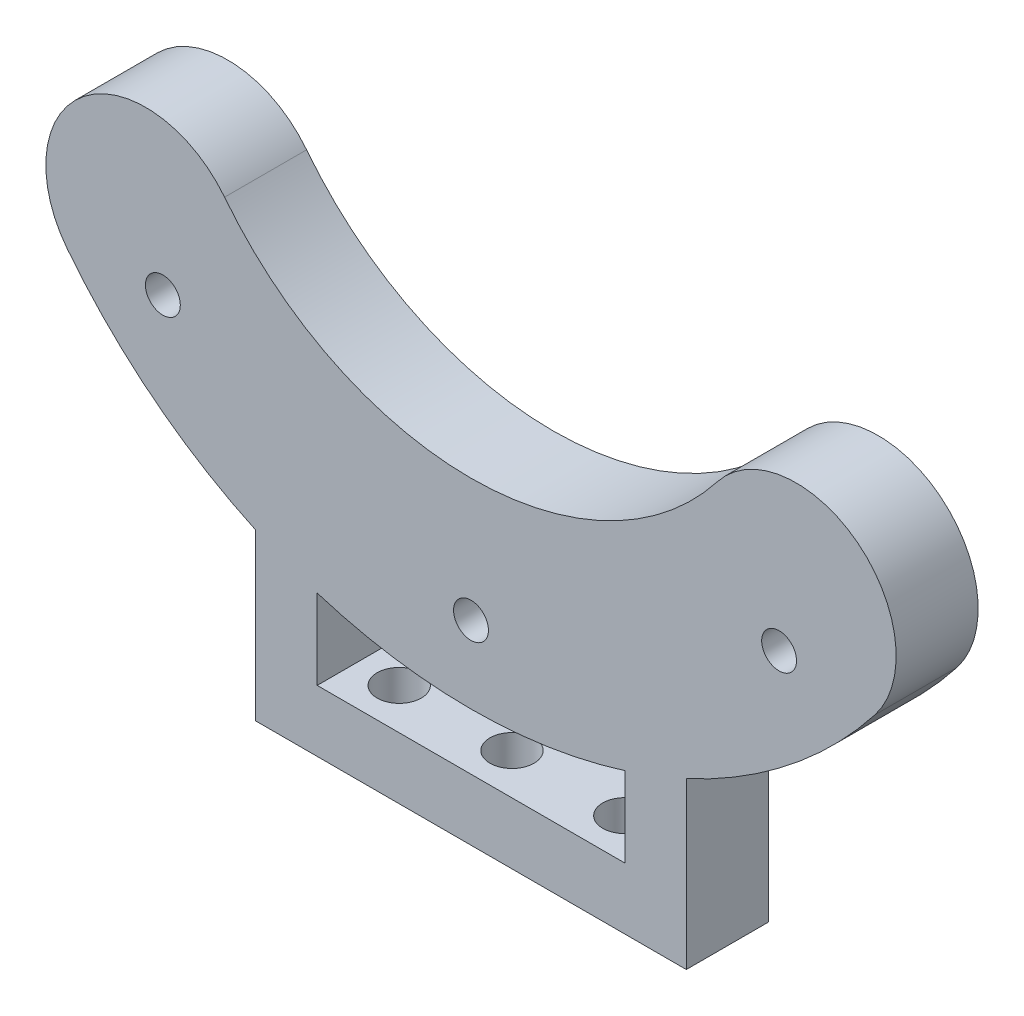
from build123d import *

# Parameters (mm, degrees)
SKETCH_1_R          = 50
SKETCH_1_R_2        = 1.7
EXTRUDE_1_DEPTH     = 8
SKETCH_2_R          = 30.5
CUT_EXTRUDE_1_DEPTH = 8
CUT_EXTRUDE_6_DEPTH = 84
EXTRUDE_START       = -8
EXTRUDE_5_DEPTH     = 8
SKETCH_10_R         = 2.15
CUT_EXTRUDE_7_DEPTH = 8


with BuildPart() as part:
    # 草图1 → 凸台-拉伸1 (new body)
    with BuildSketch(Plane.XY):
        Circle(SKETCH_1_R)
        with Locations((0, 42.5)):
            Circle(SKETCH_1_R_2, mode=Mode.SUBTRACT)
        with Locations((30.0520382, 30.0520382)):
            Circle(SKETCH_1_R_2, mode=Mode.SUBTRACT)
        with Locations((42.5, 0)):
            Circle(SKETCH_1_R_2, mode=Mode.SUBTRACT)
        with Locations((30.0520382, -30.0520382)):
            Circle(SKETCH_1_R_2, mode=Mode.SUBTRACT)
        with Locations((0, -42.5)):
            Circle(SKETCH_1_R_2, mode=Mode.SUBTRACT)
        with Locations((-30.0520382, -30.0520382)):
            Circle(SKETCH_1_R_2, mode=Mode.SUBTRACT)
        with Locations((-42.5, 0)):
            Circle(SKETCH_1_R_2, mode=Mode.SUBTRACT)
        with Locations((-30.0520382, 30.0520382)):
            Circle(SKETCH_1_R_2, mode=Mode.SUBTRACT)
    extrude(amount=EXTRUDE_1_DEPTH)

    # 草图2 → 切除-拉伸1 (cut)
    with BuildSketch(Plane.XY.offset(8)):
        Circle(SKETCH_2_R)
    extrude(amount=-CUT_EXTRUDE_1_DEPTH, mode=Mode.SUBTRACT)

    # 草图3 → 切除-拉伸6 (cut)
    with BuildSketch(Plane.XY.offset(8)):
        with BuildLine():
            ThreePointArc((-39.400537164, -30.783074428), (-37.720132642, -17.097269866), (-24.034328132, -18.77767481))
            ThreePointArc((-24.034328132, -18.77767481), (9.7e-08, 30.5), (24.034328012, -18.777674963))
            ThreePointArc((24.034328012, -18.777674963), (37.720132595, -17.097269829), (39.400537117, -30.783074488))
            ThreePointArc((39.400537117, -30.783074488), (3.8e-08, 50), (-39.400537164, -30.783074428))
        make_face()
    extrude(amount=-CUT_EXTRUDE_6_DEPTH, mode=Mode.SUBTRACT)

    # 草图8 → 凸台-拉伸5 (add)
    with BuildSketch(Plane.XY.offset(8).offset(EXTRUDE_START)):
        with BuildLine():
            ThreePointArc((-15, -47.696960071), (-18.037363326, -46.633180507), (-21, -45.376205218))
            Line((-21, -45.376205218), (-21, -61.5))
            Line((-21, -61.5), (21, -61.5))
            Line((21, -61.5), (21, -45.376205218))
            ThreePointArc((21, -45.376205218), (18.037363326, -46.633180507), (15, -47.696960071))
            Line((15, -47.696960071), (15, -55.5))
            Line((15, -55.5), (-15, -55.5))
            Line((-15, -55.5), (-15, -47.696960071))
        make_face()
    extrude(amount=EXTRUDE_5_DEPTH)

    # 草图10 → 切除-拉伸7 (cut)
    with BuildSketch(Plane.XZ.offset(61.5)):
        with Locations((-11, 4)):
            Circle(SKETCH_10_R)
        with Locations((0, 4)):
            Circle(SKETCH_10_R)
        with Locations(Location((11, 4, 0), (0, 0, 270))):
            Circle(SKETCH_10_R)
    extrude(amount=-CUT_EXTRUDE_7_DEPTH, mode=Mode.SUBTRACT)


solid = part.part
